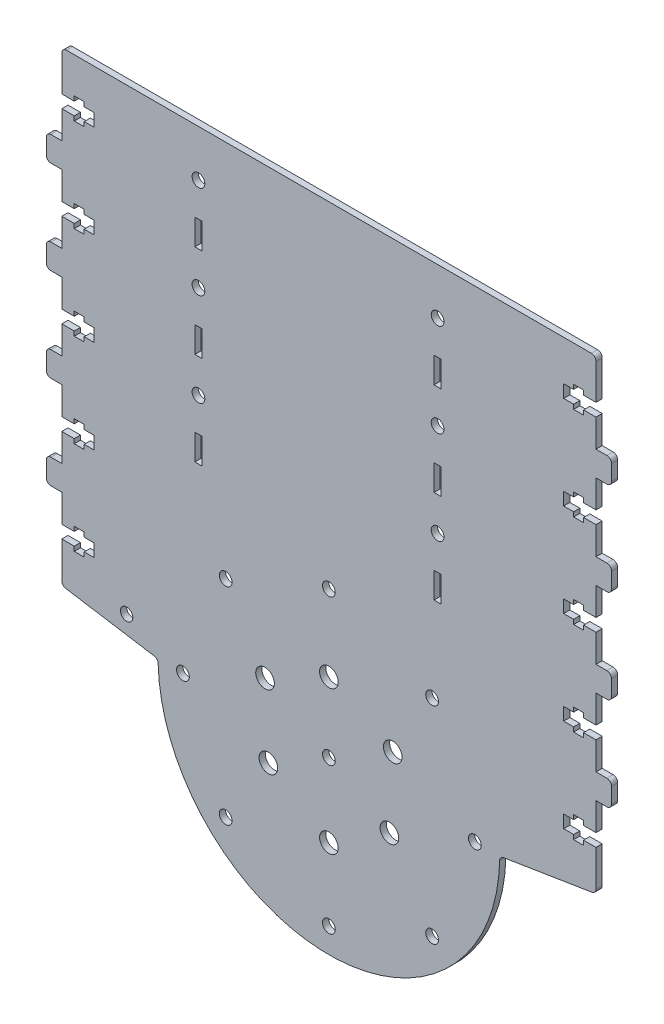
from build123d import *

# Parameters (mm, degrees)
SKETCH_1_R      = 2.05
SKETCH_1_R_2    = 3
SKETCH_1_R_3    = 2
SKETCH_1_W      = 2.3
SKETCH_1_H      = 8.3
EXTRUDE_1_DEPTH = 2
FILLET_1_R      = 1.5


with BuildPart() as part:
    # 草图1 → 凸台-拉伸1 (new body)
    with BuildSketch(Plane.XY):
        with BuildLine():
            Line((143, 45.95), (147, 45.95))
            Line((147, 45.95), (147, 44.5))
            Line((147, 44.5), (150.2, 44.5))
            Line((150.2, 44.5), (150.2, 45.95))
            Line((150.2, 45.95), (153.4, 45.95))
            Line((153.4, 45.95), (153.4, 50.05))
            Line((153.4, 50.05), (150.2, 50.05))
            Line((150.2, 50.05), (150.2, 51.5))
            Line((150.2, 51.5), (147, 51.5))
            Line((147, 51.5), (147, 50.05))
            Line((147, 50.05), (143, 50.05))
            Line((143, 50.05), (143, 59))
            Line((143, 59), (138, 59))
            Line((138, 59), (138, 67))
            Line((138, 67), (143, 67))
            Line((143, 67), (143, 75.95))
            Line((143, 75.95), (147, 75.95))
            Line((147, 75.95), (147, 74.5))
            Line((147, 74.5), (150.2, 74.5))
            Line((150.2, 74.5), (150.2, 75.95))
            Line((150.2, 75.95), (153.4, 75.95))
            Line((153.4, 75.95), (153.4, 80.05))
            Line((153.4, 80.05), (150.2, 80.05))
            Line((150.2, 80.05), (150.2, 81.5))
            Line((150.2, 81.5), (147, 81.5))
            Line((147, 81.5), (147, 80.05))
            Line((147, 80.05), (143, 80.05))
            Line((143, 80.05), (143, 89))
            Line((143, 89), (138, 89))
            Line((138, 89), (138, 97))
            Line((138, 97), (143, 97))
            Line((143, 97), (143, 105.95))
            Line((143, 105.95), (147, 105.95))
            Line((147, 105.95), (147, 104.5))
            Line((147, 104.5), (150.2, 104.5))
            Line((150.2, 104.5), (150.2, 105.95))
            Line((150.2, 105.95), (153.4, 105.95))
            Line((153.4, 105.95), (153.4, 110.05))
            Line((153.4, 110.05), (150.2, 110.05))
            Line((150.2, 110.05), (150.2, 111.5))
            Line((150.2, 111.5), (147, 111.5))
            Line((147, 111.5), (147, 110.05))
            Line((147, 110.05), (143, 110.05))
            Line((143, 110.05), (143, 119))
            Line((143, 119), (143, 123))
            Line((143, 123), (315, 123))
            Line((315, 123), (315, 119))
            Line((315, 119), (315, 110.05))
            Line((315, 110.05), (311, 110.05))
            Line((311, 110.05), (311, 111.5))
            Line((311, 111.5), (307.8, 111.5))
            Line((307.8, 111.5), (307.8, 110.05))
            Line((307.8, 110.05), (304.6, 110.05))
            Line((304.6, 110.05), (304.6, 105.95))
            Line((304.6, 105.95), (307.8, 105.95))
            Line((307.8, 105.95), (307.8, 104.5))
            Line((307.8, 104.5), (311, 104.5))
            Line((311, 104.5), (311, 105.95))
            Line((311, 105.95), (315, 105.95))
            Line((315, 105.95), (315, 97))
            Line((315, 97), (320, 97))
            Line((320, 97), (320, 89))
            Line((320, 89), (315, 89))
            Line((315, 89), (315, 80.05))
            Line((315, 80.05), (311, 80.05))
            Line((311, 80.05), (311, 81.5))
            Line((311, 81.5), (307.8, 81.5))
            Line((307.8, 81.5), (307.8, 80.05))
            Line((307.8, 80.05), (304.6, 80.05))
            Line((304.6, 80.05), (304.6, 75.95))
            Line((304.6, 75.95), (307.8, 75.95))
            Line((307.8, 75.95), (307.8, 74.5))
            Line((307.8, 74.5), (311, 74.5))
            Line((311, 74.5), (311, 75.95))
            Line((311, 75.95), (315, 75.95))
            Line((315, 75.95), (315, 67))
            Line((315, 67), (320, 67))
            Line((320, 67), (320, 59))
            Line((320, 59), (315, 59))
            Line((315, 59), (315, 50.05))
            Line((315, 50.05), (311, 50.05))
            Line((311, 50.05), (311, 51.5))
            Line((311, 51.5), (307.8, 51.5))
            Line((307.8, 51.5), (307.8, 50.05))
            Line((307.8, 50.05), (304.6, 50.05))
            Line((304.6, 50.05), (304.6, 45.95))
            Line((304.6, 45.95), (307.8, 45.95))
            Line((307.8, 45.95), (307.8, 44.5))
            Line((307.8, 44.5), (311, 44.5))
            Line((311, 44.5), (311, 45.95))
            Line((311, 45.95), (315, 45.95))
            Line((315, 45.95), (315, 37))
            Line((315, 37), (320, 37))
            Line((320, 37), (320, 29))
            Line((320, 29), (315, 29))
            Line((315, 29), (315, 20.05))
            Line((315, 20.05), (311, 20.05))
            Line((311, 20.05), (311, 21.5))
            Line((311, 21.5), (307.8, 21.5))
            Line((307.8, 21.5), (307.8, 20.05))
            Line((307.8, 20.05), (304.6, 20.05))
            Line((304.6, 20.05), (304.6, 15.95))
            Line((304.6, 15.95), (307.8, 15.95))
            Line((307.8, 15.95), (307.8, 14.5))
            Line((307.8, 14.5), (311, 14.5))
            Line((311, 14.5), (311, 15.95))
            Line((311, 15.95), (315, 15.95))
            Line((315, 15.95), (315, 7))
            Line((315, 7), (320, 7))
            Line((320, 7), (320, -1))
            Line((320, -1), (315, -1))
            Line((315, -1), (315, -9.95))
            Line((315, -9.95), (311, -9.95))
            Line((311, -9.95), (311, -8.5))
            Line((311, -8.5), (307.8, -8.5))
            Line((307.8, -8.5), (307.8, -9.95))
            Line((307.8, -9.95), (304.6, -9.95))
            Line((304.6, -9.95), (304.6, -14.05))
            Line((304.6, -14.05), (307.8, -14.05))
            Line((307.8, -14.05), (307.8, -15.5))
            Line((307.8, -15.5), (311, -15.5))
            Line((311, -15.5), (311, -14.05))
            Line((311, -14.05), (315, -14.05))
            Line((315, -14.05), (315, -27))
            Line((315, -27), (284, -32))
            ThreePointArc((284, -32), (229, -87), (174, -32))
            Line((174, -32), (143, -27))
            Line((143, -27), (143, -14.05))
            Line((143, -14.05), (147, -14.05))
            Line((147, -14.05), (147, -15.5))
            Line((147, -15.5), (150.2, -15.5))
            Line((150.2, -15.5), (150.2, -14.05))
            Line((150.2, -14.05), (153.4, -14.05))
            Line((153.4, -14.05), (153.4, -9.95))
            Line((153.4, -9.95), (150.2, -9.95))
            Line((150.2, -9.95), (150.2, -8.5))
            Line((150.2, -8.5), (147, -8.5))
            Line((147, -8.5), (147, -9.95))
            Line((147, -9.95), (143, -9.95))
            Line((143, -9.95), (143, -1))
            Line((143, -1), (138, -1))
            Line((138, -1), (138, 7))
            Line((138, 7), (143, 7))
            Line((143, 7), (143, 15.95))
            Line((143, 15.95), (147, 15.95))
            Line((147, 15.95), (147, 14.5))
            Line((147, 14.5), (150.2, 14.5))
            Line((150.2, 14.5), (150.2, 15.95))
            Line((150.2, 15.95), (153.4, 15.95))
            Line((153.4, 15.95), (153.4, 20.05))
            Line((153.4, 20.05), (150.2, 20.05))
            Line((150.2, 20.05), (150.2, 21.5))
            Line((150.2, 21.5), (147, 21.5))
            Line((147, 21.5), (147, 20.05))
            Line((147, 20.05), (143, 20.05))
            Line((143, 20.05), (143, 29))
            Line((143, 29), (138, 29))
            Line((138, 29), (138, 37))
            Line((138, 37), (143, 37))
            Line((143, 37), (143, 45.95))
        make_face()
        with Locations((187, 108)):
            Circle(SKETCH_1_R, mode=Mode.SUBTRACT)
        with Locations((229, -55.75)):
            Circle(SKETCH_1_R_2, mode=Mode.SUBTRACT)
        with Locations((248.485571585, -43.25)):
            Circle(SKETCH_1_R_2, mode=Mode.SUBTRACT)
        with Locations((229, -32)):
            Circle(SKETCH_1_R, mode=Mode.SUBTRACT)
        with Locations((276, -32)):
            Circle(SKETCH_1_R, mode=Mode.SUBTRACT)
        with Locations((208.43189666, -20.125)):
            Circle(SKETCH_1_R_2, mode=Mode.SUBTRACT)
        with Locations((249.56810334, -20.125)):
            Circle(SKETCH_1_R_2, mode=Mode.SUBTRACT)
        with Locations((209.514428415, -43.25)):
            Circle(SKETCH_1_R_2, mode=Mode.SUBTRACT)
        with Locations((229, -9.5)):
            Circle(SKETCH_1_R_2, mode=Mode.SUBTRACT)
        with Locations((187, 78)):
            Circle(SKETCH_1_R, mode=Mode.SUBTRACT)
        with Locations((187, 48)):
            Circle(SKETCH_1_R, mode=Mode.SUBTRACT)
        with Locations((262.234018716, -65.234018716)):
            Circle(SKETCH_1_R, mode=Mode.SUBTRACT)
        with Locations((229, -79)):
            Circle(SKETCH_1_R, mode=Mode.SUBTRACT)
        with Locations((195.765981284, -65.234018716)):
            Circle(SKETCH_1_R, mode=Mode.SUBTRACT)
        with Locations((182, -32)):
            Circle(SKETCH_1_R, mode=Mode.SUBTRACT)
        with Locations((195.765981284, 1.234018716)):
            Circle(SKETCH_1_R, mode=Mode.SUBTRACT)
        with Locations((229, 15)):
            Circle(SKETCH_1_R, mode=Mode.SUBTRACT)
        with Locations((262.234018716, 1.234018716)):
            Circle(SKETCH_1_R, mode=Mode.SUBTRACT)
        with Locations((163.858283099, -24.571784035)):
            Circle(SKETCH_1_R_3, mode=Mode.SUBTRACT)
        with Locations((264, 108)):
            Circle(SKETCH_1_R, mode=Mode.SUBTRACT)
        with Locations((264, 78)):
            Circle(SKETCH_1_R, mode=Mode.SUBTRACT)
        with Locations((264, 48)):
            Circle(SKETCH_1_R, mode=Mode.SUBTRACT)
        with Locations((187, 93)):
            Rectangle(SKETCH_1_W, SKETCH_1_H, mode=Mode.SUBTRACT)
        with Locations((187, 63)):
            Rectangle(SKETCH_1_W, SKETCH_1_H, mode=Mode.SUBTRACT)
        with Locations((187, 33)):
            Rectangle(SKETCH_1_W, SKETCH_1_H, mode=Mode.SUBTRACT)
        with Locations((264, 93)):
            Rectangle(SKETCH_1_W, SKETCH_1_H, mode=Mode.SUBTRACT)
        with Locations((264, 63)):
            Rectangle(SKETCH_1_W, SKETCH_1_H, mode=Mode.SUBTRACT)
        with Locations((264, 33)):
            Rectangle(SKETCH_1_W, SKETCH_1_H, mode=Mode.SUBTRACT)
    extrude(amount=EXTRUDE_1_DEPTH)

    # 圆角1
    fillet_1_edges = [part.edges().sort_by_distance(p)[0] for p in [
        (143, -27, 1),
        (138, -1, 1),
        (138, 7, 1),
        (138, 29, 1),
        (138, 37, 1),
        (138, 59, 1),
        (138, 67, 1),
        (138, 89, 1),
        (138, 97, 1),
        (143, 123, 1),
        (315, 123, 1),
        (320, 97, 1),
        (320, 89, 1),
        (320, 67, 1),
        (320, 59, 1),
        (320, 37, 1),
        (320, 29, 1),
        (320, 7, 1),
        (320, -1, 1),
        (315, -27, 1),
        (284, -32, 1),
        (174, -32, 1),
    ]]
    fillet(fillet_1_edges, radius=FILLET_1_R)


solid = part.part
